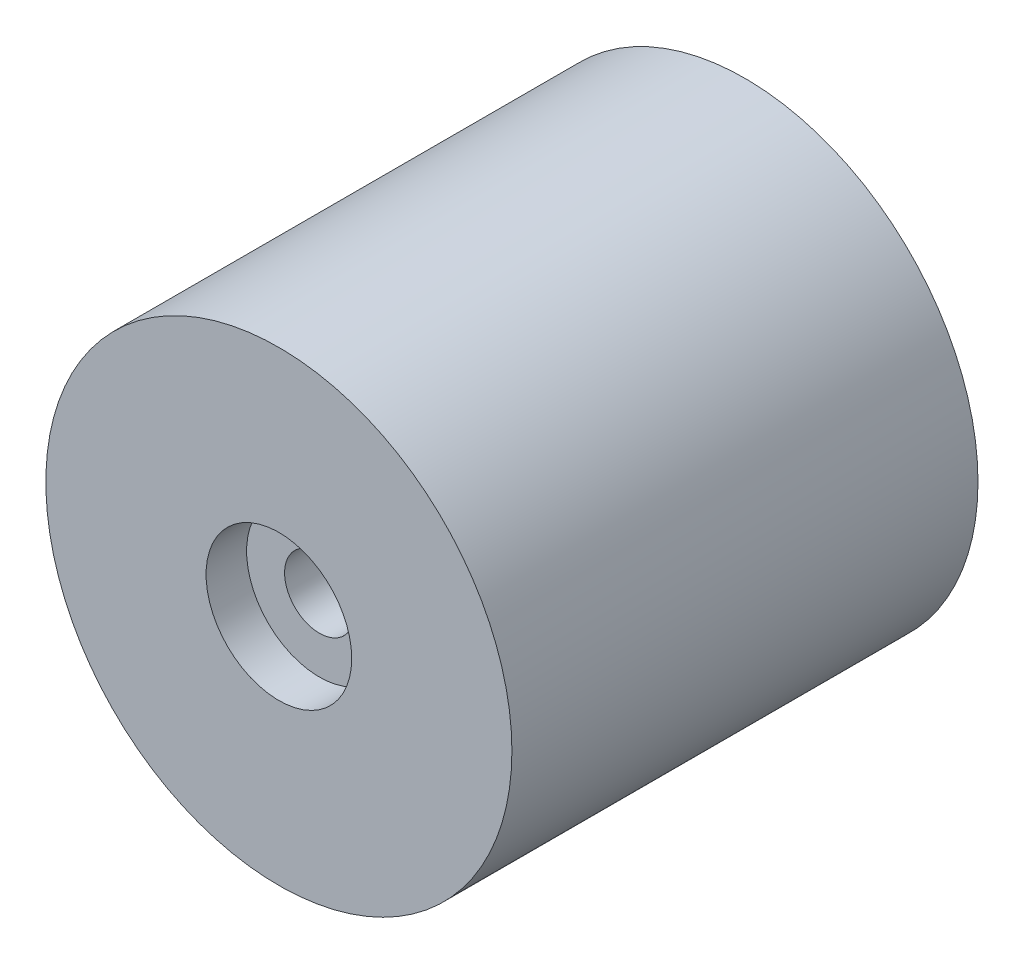
from build123d import *

# Parameters (mm, degrees)
SKETCH1_R                                           = 12.7
BOSS_EXTRUDE1_DEPTH                                 = 25.4
CBORE_FOR_6_BINDING_HEAD_MACHINE_SCREW1_D           = 3.7973
CBORE_FOR_6_BINDING_HEAD_MACHINE_SCREW1_CBORE_D     = 7.9375
CBORE_FOR_6_BINDING_HEAD_MACHINE_SCREW1_CBORE_DEPTH = 2.2098


with BuildPart() as part:
    # Sketch1 → Boss-Extrude1 (new body)
    with BuildSketch(Plane.XY):
        Circle(SKETCH1_R)
    extrude(amount=-BOSS_EXTRUDE1_DEPTH)

    # CBORE for #6 Binding Head Machine Screw1 (through all)
    with Locations(Plane.XY):
        with Locations((0, 0)):
            CounterBoreHole(CBORE_FOR_6_BINDING_HEAD_MACHINE_SCREW1_D / 2, CBORE_FOR_6_BINDING_HEAD_MACHINE_SCREW1_CBORE_D / 2, CBORE_FOR_6_BINDING_HEAD_MACHINE_SCREW1_CBORE_DEPTH)


solid = part.part
